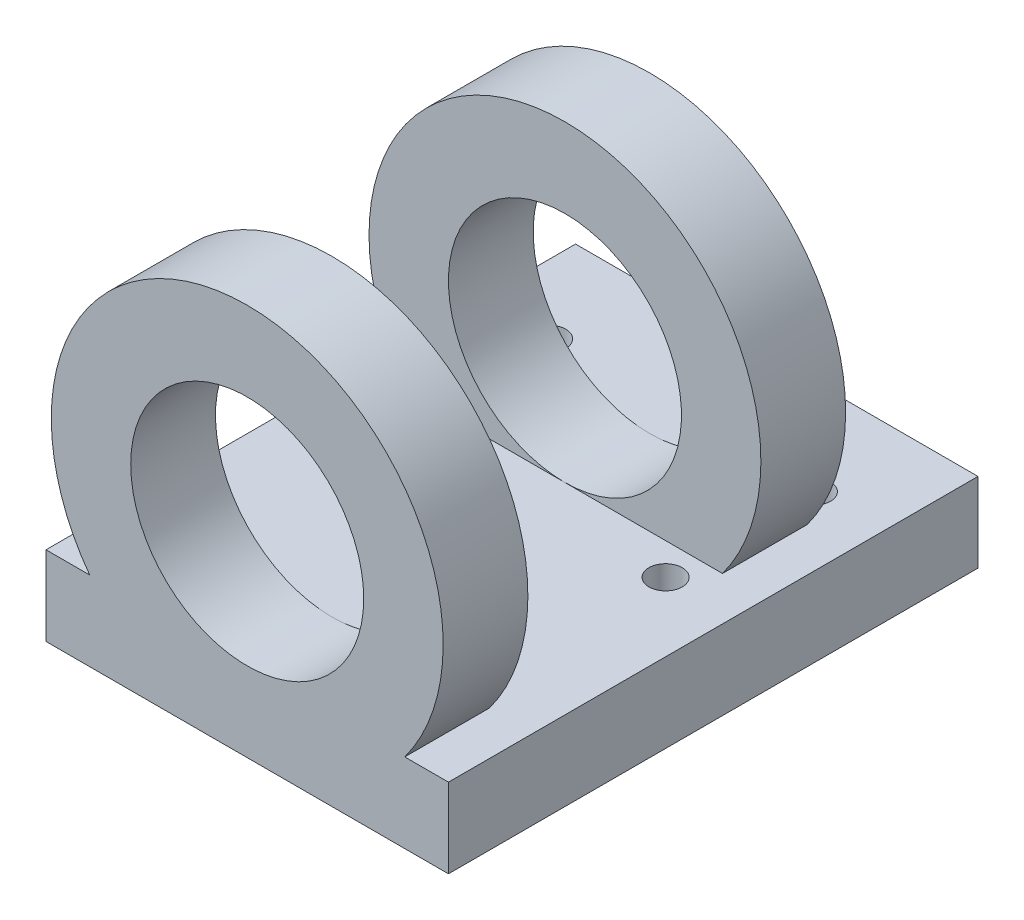
from build123d import *

# Parameters (mm, degrees)
ESQUISSE1_R                = 18.5
ESQUISSE1_R_2              = 11
BOSS_EXTRU_19_DEPTH        = 8
BOSS_EXTRU_20_DEPTH        = 30
BOSS_EXTRU_20_DEPTH_BACK   = 20
ESQUISSE1_5_W              = 38
ESQUISSE1_5_H              = 7.5
R_P_TITION_LIN_AIRE1_COUNT = 2
R_P_TITION_LIN_AIRE1_PITCH = 30
ENL_V_MAT_EXTRU_1_REACH    = 48.165
ESQUISSE8_R                = 1.575


with BuildPart() as part:
    # Esquisse1 → Boss.-Extru.19 (new body)
    with BuildSketch(Plane.XY):
        Circle(ESQUISSE1_R)
        Circle(ESQUISSE1_R_2, mode=Mode.SUBTRACT)
    boss_extru_19 = extrude(amount=-BOSS_EXTRU_19_DEPTH)

    # Esquisse1<5> → Boss.-Extru.20 (add, two sides: drawn at the far end of the back side and taken through both)
    with BuildSketch(Plane.XY.offset(-BOSS_EXTRU_20_DEPTH_BACK)):
        with Locations((0, -14.75)):
            Rectangle(ESQUISSE1_5_W, ESQUISSE1_5_H)
    extrude(amount=BOSS_EXTRU_20_DEPTH + BOSS_EXTRU_20_DEPTH_BACK)

    # Répétition linéaire1: Boss.-Extru.19 ×2
    with Locations(*[(0, 0, i * R_P_TITION_LIN_AIRE1_PITCH) for i in range(1, R_P_TITION_LIN_AIRE1_COUNT)]):
        add(boss_extru_19)

    # Esquisse8 → Enlèv. mat.-Extru.1 (cut, up to next)
    with BuildSketch(Plane(origin=(0, -11, 0), x_dir=(1, 0, 0), z_dir=(0, 1, 0)), mode=Mode.PRIVATE) as enl_v_mat_extru_1_sk1:
        with Locations((-12.5, 11)):
            Circle(ESQUISSE8_R)
    enl_v_mat_extru_1_tool1 = extrude(enl_v_mat_extru_1_sk1.sketch, amount=-ENL_V_MAT_EXTRU_1_REACH, mode=Mode.PRIVATE) & part.part
    # Esquisse8 → Enlèv. mat.-Extru.1 (cut, up to next)
    with BuildSketch(Plane(origin=(0, -11, 0), x_dir=(1, 0, 0), z_dir=(0, 1, 0)), mode=Mode.PRIVATE) as enl_v_mat_extru_1_sk2:
        with Locations((12.5, 11)):
            Circle(ESQUISSE8_R)
    enl_v_mat_extru_1_tool2 = extrude(enl_v_mat_extru_1_sk2.sketch, amount=-ENL_V_MAT_EXTRU_1_REACH, mode=Mode.PRIVATE) & part.part
    # Esquisse8 → Enlèv. mat.-Extru.1 (cut, up to next)
    with BuildSketch(Plane(origin=(0, -11, 0), x_dir=(1, 0, 0), z_dir=(0, 1, 0)), mode=Mode.PRIVATE) as enl_v_mat_extru_1_sk3:
        with Locations((12.5, -3)):
            Circle(ESQUISSE8_R)
    enl_v_mat_extru_1_tool3 = extrude(enl_v_mat_extru_1_sk3.sketch, amount=-ENL_V_MAT_EXTRU_1_REACH, mode=Mode.PRIVATE) & part.part
    # Esquisse8 → Enlèv. mat.-Extru.1 (cut, up to next)
    with BuildSketch(Plane(origin=(0, -11, 0), x_dir=(1, 0, 0), z_dir=(0, 1, 0)), mode=Mode.PRIVATE) as enl_v_mat_extru_1_sk4:
        with Locations((-12.5, -3)):
            Circle(ESQUISSE8_R)
    enl_v_mat_extru_1_tool4 = extrude(enl_v_mat_extru_1_sk4.sketch, amount=-ENL_V_MAT_EXTRU_1_REACH, mode=Mode.PRIVATE) & part.part
    add(enl_v_mat_extru_1_tool1.solids().sort_by_distance((-12.5, -11, -11))[0], mode=Mode.SUBTRACT)
    add(enl_v_mat_extru_1_tool2.solids().sort_by_distance((12.5, -11, -11))[0], mode=Mode.SUBTRACT)
    add(enl_v_mat_extru_1_tool3.solids().sort_by_distance((12.5, -11, 3))[0], mode=Mode.SUBTRACT)
    add(enl_v_mat_extru_1_tool4.solids().sort_by_distance((-12.5, -11, 3))[0], mode=Mode.SUBTRACT)


solid = part.part
